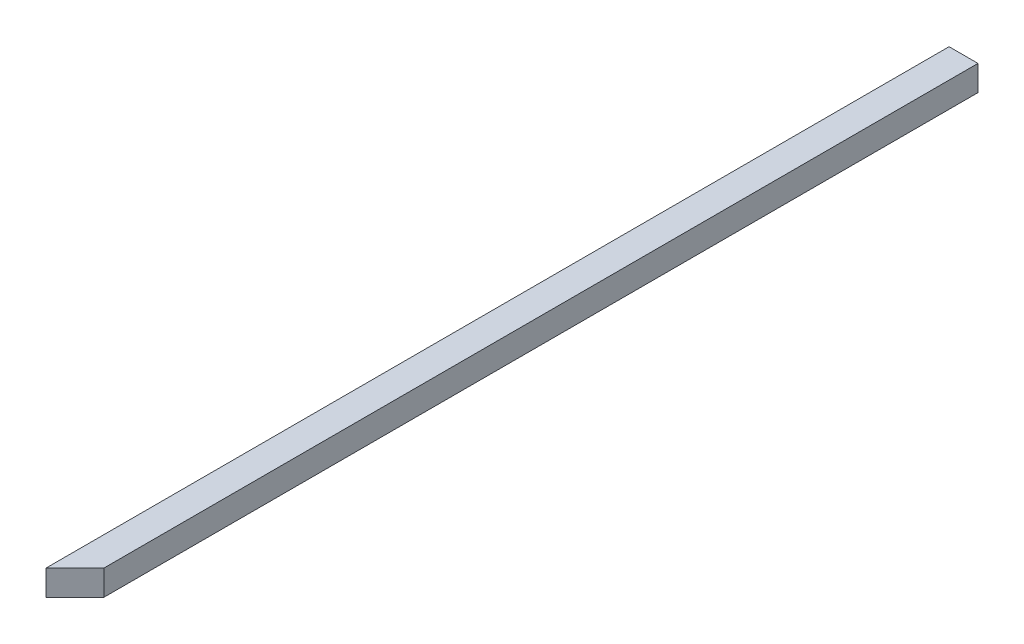
from build123d import *

# Parameters (mm, degrees)
CROQUIS1_W              = 4
CROQUIS1_H              = 3.5
SALIENTE_EXTRUIR1_DEPTH = 120.829699
SALIENTE_EXTRUIR2_DEPTH = 3.5


with BuildPart() as part:
    # Croquis1 → Saliente-Extruir1 (new body)
    with BuildSketch(Plane.XY):
        with Locations((171.47767153, -1.75)):
            Rectangle(CROQUIS1_W, CROQUIS1_H)
    extrude(amount=SALIENTE_EXTRUIR1_DEPTH)


with BuildPart() as saliente_extruir2_tool:
    # Croquis2 → Saliente-Extruir2 (new body)
    with BuildSketch(Plane.XZ.offset(3.5)):
        Polygon((169.47767153, 120.82969947), (169.47767153, 124.82969947), (173.47767153, 120.82969947), align=None)
    extrude(amount=-SALIENTE_EXTRUIR2_DEPTH)


with BuildPart() as part_1:
    add(part.part)


with BuildPart() as part_2:
    # Saliente-Extruir2: joined with saliente_extruir2_tool
    add(part_1.part.fuse(saliente_extruir2_tool.part, tol=0.00001))


solid = part_2.part
